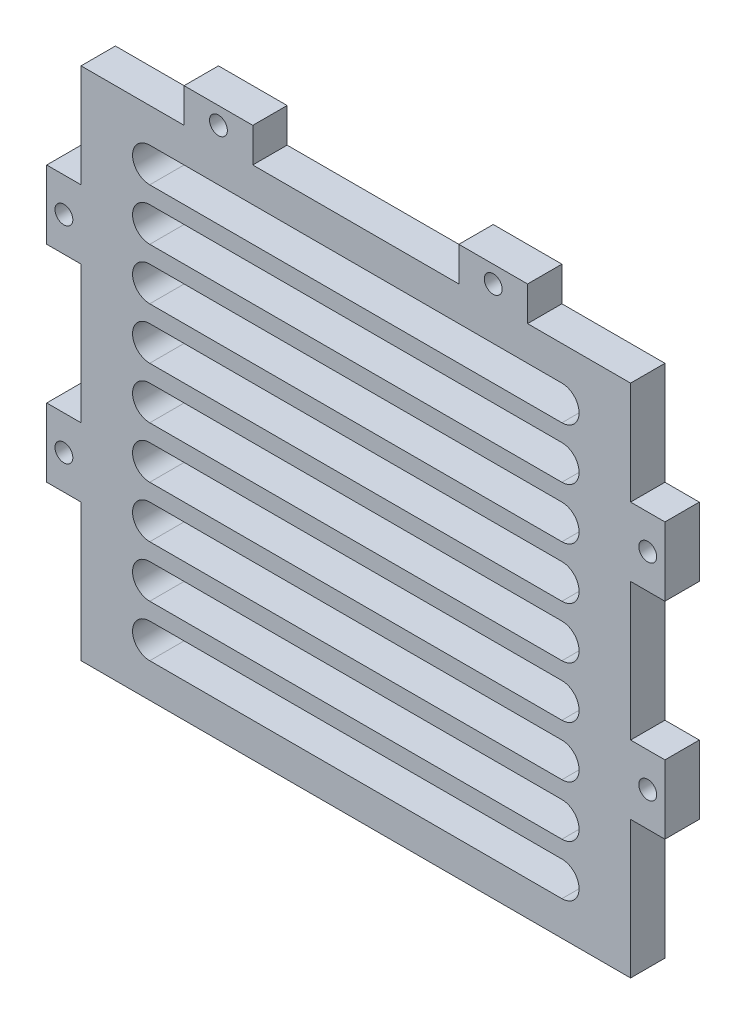
from build123d import *

# Parameters (mm, degrees)
SKETCH1_W           = 101.6
SKETCH1_H           = 95.25
BOSS_EXTRUDE1_DEPTH = 6.35
SKETCH2_W           = 12.7
SKETCH2_H           = 6.35
SKETCH2_R           = 1.651
SKETCH2_W_2         = 6.35
SKETCH2_H_2         = 12.7
BOSS_EXTRUDE2_DEPTH = 6.35
CUT_EXTRUDE1_DEPTH  = 80.746567925
LPATTERN1_COUNT     = 9
LPATTERN1_PITCH     = 9.525


with BuildPart() as part:
    # Sketch1 → Boss-Extrude1 (new body)
    with BuildSketch(Plane.XY):
        with Locations((0, -7.629593436)):
            Rectangle(SKETCH1_W, SKETCH1_H)
    extrude(amount=BOSS_EXTRUDE1_DEPTH)

    # Sketch2 → Boss-Extrude2 (add)
    # profile 1 of 6: a face of its own
    with BuildSketch(Plane.XY.offset(6.35)):
        with Locations((-25.4, 43.170406564)):
            Rectangle(SKETCH2_W, SKETCH2_H)
        with Locations((-25.4, 43.170406564)):
            Circle(SKETCH2_R, mode=Mode.SUBTRACT)
    # profile 2 of 6: a face of its own
    with BuildSketch(Plane.XY.offset(6.35)):
        with Locations((25.4, 43.170406564)):
            Rectangle(SKETCH2_W, SKETCH2_H)
        with Locations((25.4, 43.170406564)):
            Circle(SKETCH2_R, mode=Mode.SUBTRACT)
    # profile 3 of 6: a face of its own
    with BuildSketch(Plane.XY.offset(6.35)):
        with Locations((-53.975, 14.595406564)):
            Rectangle(SKETCH2_W_2, SKETCH2_H_2)
        with Locations((-53.975, 14.595406564)):
            Circle(SKETCH2_R, mode=Mode.SUBTRACT)
    # profile 4 of 6: a face of its own
    with BuildSketch(Plane.XY.offset(6.35)):
        with Locations((53.975, 14.595406564)):
            Rectangle(SKETCH2_W_2, SKETCH2_H_2)
        with Locations((53.975, 14.595406564)):
            Circle(SKETCH2_R, mode=Mode.SUBTRACT)
    # profile 5 of 6: a face of its own
    with BuildSketch(Plane.XY.offset(6.35)):
        with Locations((-53.975, -23.504593436)):
            Rectangle(SKETCH2_W_2, SKETCH2_H_2)
        with Locations((-53.975, -23.504593436)):
            Circle(SKETCH2_R, mode=Mode.SUBTRACT)
    # profile 6 of 6: a face of its own
    with BuildSketch(Plane.XY.offset(6.35)):
        with Locations((53.975, -23.504593436)):
            Rectangle(SKETCH2_W_2, SKETCH2_H_2)
        with Locations((53.975, -23.504593436)):
            Circle(SKETCH2_R, mode=Mode.SUBTRACT)
    extrude(amount=-BOSS_EXTRUDE2_DEPTH)

    # Sketch3 → Cut-Extrude1 (cut, through all)
    with BuildSketch(Plane.XY.offset(6.35)):
        with BuildLine():
            Line((-38.1, 33.645406564), (38.1, 33.645406564))
            ThreePointArc((38.1, 33.645406564), (41.275, 30.470406564), (38.1, 27.295406564))
            Line((38.1, 27.295406564), (-38.1, 27.295406564))
            ThreePointArc((-38.1, 27.295406564), (-41.275, 30.470406564), (-38.1, 33.645406564))
        make_face()
    cut_extrude1 = extrude(amount=-CUT_EXTRUDE1_DEPTH, mode=Mode.SUBTRACT)

    # LPattern1: Cut-Extrude1 ×9
    with Locations(*[(0, -i * LPATTERN1_PITCH, 0) for i in range(1, LPATTERN1_COUNT)]):
        add(cut_extrude1, mode=Mode.SUBTRACT)


solid = part.part
